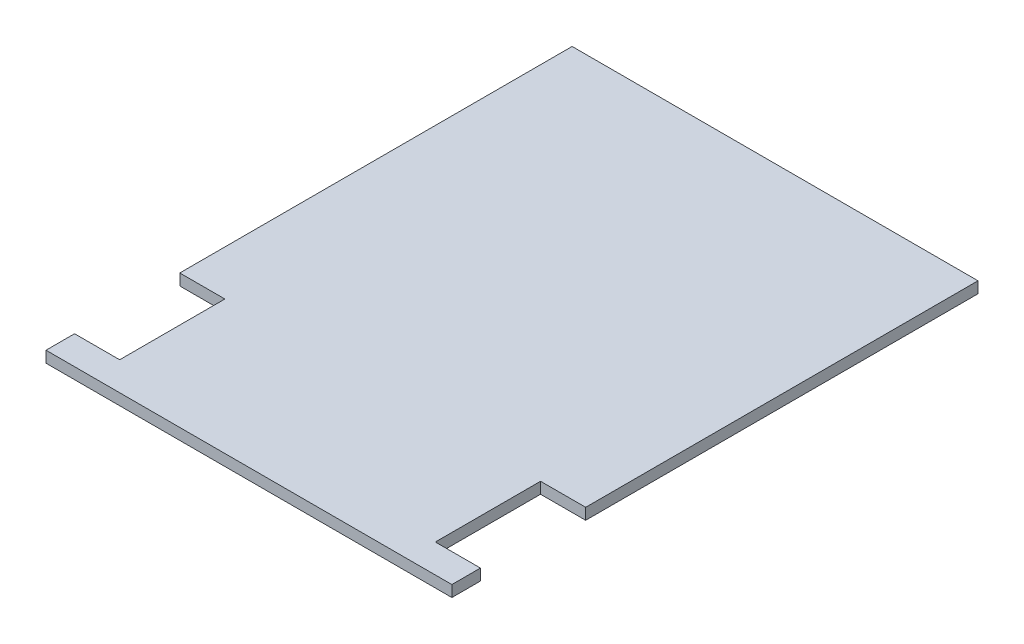
from build123d import *

# Parameters (mm, degrees)
BOSS_EXTRUDE1_DEPTH = 0.75


with BuildPart() as part:
    # Sketch1 → Boss-Extrude1 (new body)
    with BuildSketch(Plane(origin=(0, 0, 0), x_dir=(1, 0, 0), z_dir=(0, 1, 0))):
        Polygon((-19.385235072, 35), (7.614764928, 35), (7.614764928, 8.9), (4.614764928, 8.9), (4.614764928, 1.9), (7.614764928, 1.9), (7.614764928, 0), (-19.385235072, 0), (-19.385235072, 1.9), (-16.385235072, 1.9), (-16.385235072, 8.9), (-19.385235072, 8.9), align=None)
    extrude(amount=BOSS_EXTRUDE1_DEPTH)


solid = part.part
